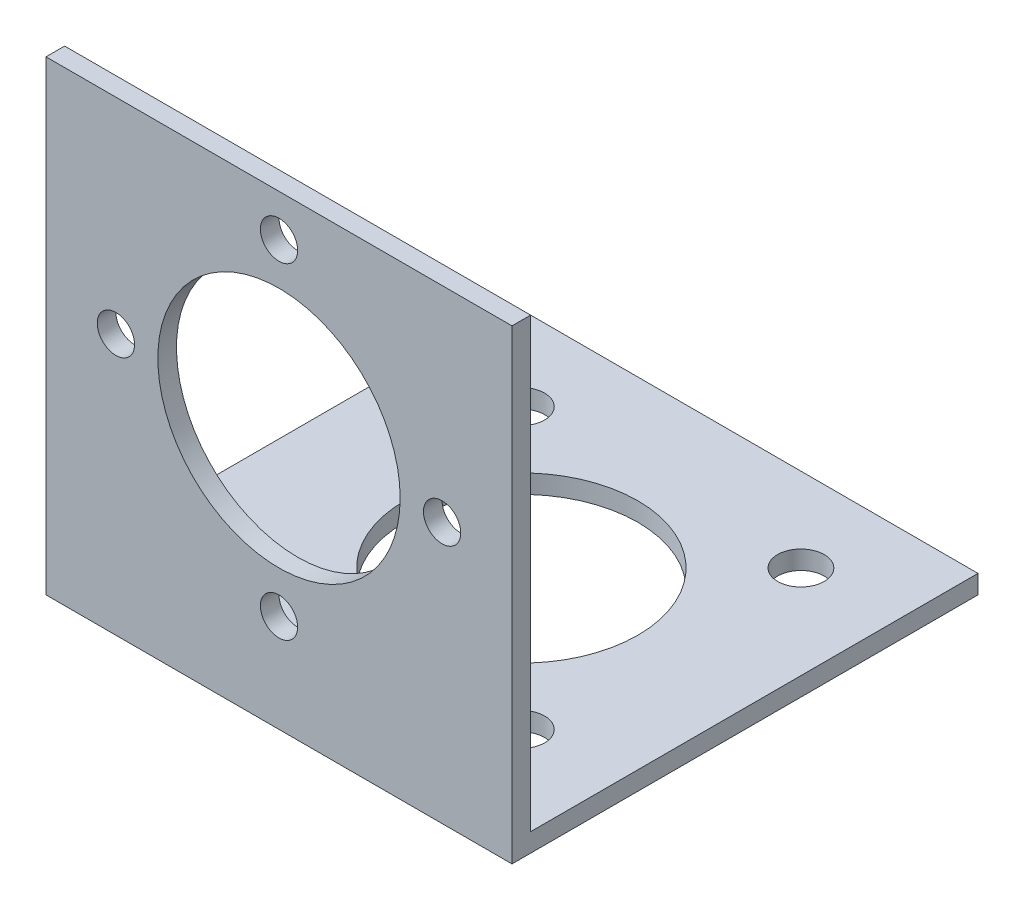
from build123d import *

# Parameters (mm, degrees)
EXTRUDE_1_DEPTH     = 50
SKETCH_2_R          = 13
SKETCH_2_R_2        = 2
CUT_EXTRUDE_1_DEPTH = 50
SKETCH_3_R          = 12.5
SKETCH_3_R_2        = 2.5
CUT_EXTRUDE_2_DEPTH = 50


with BuildPart() as part:
    # 草图1 → 凸台-拉伸1 (new body)
    with BuildSketch(Plane(origin=(0, 0, 0), x_dir=(0, 0, -1), z_dir=(1, 0, 0))):
        Polygon((0, 50), (0, 0), (50, 0), (50, 2), (2, 2), (2, 50), align=None)
    extrude(amount=EXTRUDE_1_DEPTH)

    # 草图2 → 切除-拉伸1 (cut)
    with BuildSketch(Plane.XY):
        with Locations((25, 28)):
            Circle(SKETCH_2_R)
        with Locations((7.5, 28)):
            Circle(SKETCH_2_R_2)
        with Locations((25, 45.5)):
            Circle(SKETCH_2_R_2)
        with Locations((25, 10.5)):
            Circle(SKETCH_2_R_2)
        with Locations((42.5, 28)):
            Circle(SKETCH_2_R_2)
    extrude(amount=-CUT_EXTRUDE_1_DEPTH, mode=Mode.SUBTRACT)

    # 草图3 → 切除-拉伸2 (cut)
    with BuildSketch(Plane(origin=(0, 2, 0), x_dir=(1, 0, 0), z_dir=(0, 1, 0))):
        with Locations(Location((25, 26, 0), (0, 0, 270))):
            Circle(SKETCH_3_R)
        with Locations(Location((40, 41, 0), (0, 0, 270))):
            Circle(SKETCH_3_R_2)
        with Locations(Location((40, 11, 0), (0, 0, 270))):
            Circle(SKETCH_3_R_2)
        with Locations(Location((10, 41, 0), (0, 0, 270))):
            Circle(SKETCH_3_R_2)
        with Locations(Location((10, 11, 0), (0, 0, 270))):
            Circle(SKETCH_3_R_2)
    extrude(amount=-CUT_EXTRUDE_2_DEPTH, mode=Mode.SUBTRACT)


solid = part.part
